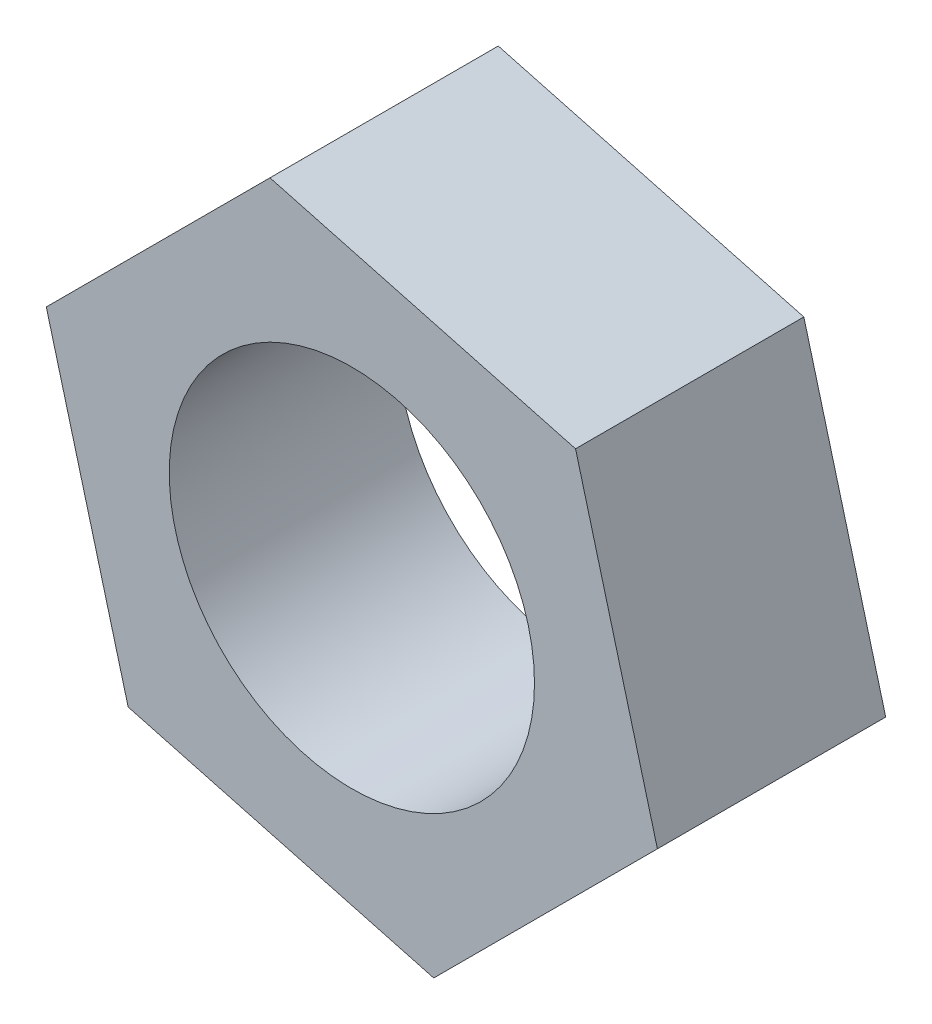
from build123d import *

# Parameters (mm, degrees)
CROQUIS1_R              = 6
CROQUIS1_R_2            = 2.5
SALIENTE_EXTRUIR1_DEPTH = 5
CROQUIS2_R              = 4
SALIENTE_EXTRUIR2_DEPTH = 5
CROQUIS3_R              = 4
CORTAR_EXTRUIR1_DEPTH   = 10


with BuildPart() as part:
    # Croquis1 → Saliente-Extruir1 (new body)
    with BuildSketch(Plane.XY):
        Circle(CROQUIS1_R)
        Circle(CROQUIS1_R_2, mode=Mode.SUBTRACT)
    extrude(amount=SALIENTE_EXTRUIR1_DEPTH)

    # Croquis2 → Saliente-Extruir2 (add)
    with BuildSketch(Plane.XY.offset(5)):
        Polygon((-6.692111353, 1.79322214), (-1.793079748, 6.692149506), (4.899031604, 4.898927366), (6.692111353, -1.79322214), (1.793079748, -6.692149506), (-4.899031604, -4.898927366), align=None)
        Circle(CROQUIS2_R, mode=Mode.SUBTRACT)
    extrude(amount=-SALIENTE_EXTRUIR2_DEPTH)

    # Croquis3 → Cortar-Extruir1 (cut)
    with BuildSketch(Plane.XY.offset(5)):
        Circle(CROQUIS3_R)
    extrude(amount=-CORTAR_EXTRUIR1_DEPTH, mode=Mode.SUBTRACT)


solid = part.part
